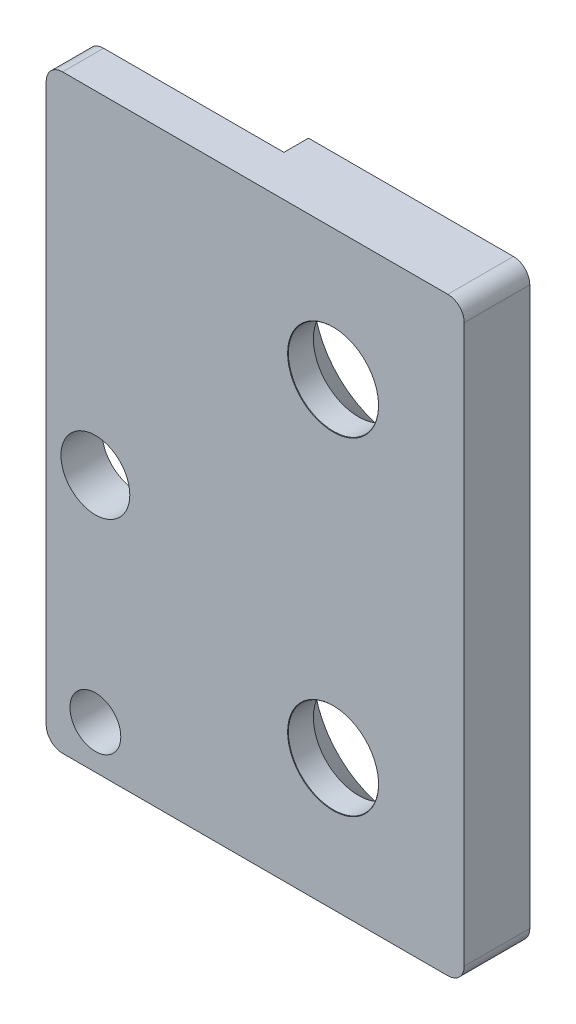
from build123d import *

# Parameters (mm, degrees)
SKETCH1_W                                    = 25.5
SKETCH1_H                                    = 36
BOSS_EXTRUDE1_DEPTH                          = 4
CUT_EXTRUDE1_REACH                           = 40.4
SKETCH2_W                                    = 12
SKETCH2_H                                    = 1.5
CSK_FOR_M5_COUNTERSUNK_FLAT_HEAD_SCR_2_COUNT = 2
CSK_FOR_M5_COUNTERSUNK_FLAT_HEAD_SCR_2_PITCH = 20
M3_CLEARANCE_HOLE1_D                         = 3.1
HOLE1_D                                      = 4.2
FILLET1_R                                    = 1


with BuildPart() as part:
    # Sketch1 → Boss-Extrude1 (new body)
    with BuildSketch(Plane.XY):
        Rectangle(SKETCH1_W, SKETCH1_H)
    extrude(amount=BOSS_EXTRUDE1_DEPTH)

    # Sketch2 → Cut-Extrude1 (cut, up to next)
    with BuildSketch(Plane(origin=(0, 18, 0), x_dir=(1, 0, 0), z_dir=(0, 1, 0)), mode=Mode.PRIVATE) as cut_extrude1_sk1:
        with Locations((-6.75, -0.75)):
            Rectangle(SKETCH2_W, SKETCH2_H)
    cut_extrude1_tool1 = extrude(cut_extrude1_sk1.sketch, amount=-CUT_EXTRUDE1_REACH, mode=Mode.PRIVATE) & part.part
    add(cut_extrude1_tool1.solids().sort_by_distance((-6.75, 18, 0.75))[0], mode=Mode.SUBTRACT)

    # Sketch5 → CSK for M5 Countersunk Flat Head Screw1 (revolve, cut)
    with BuildSketch(Plane(origin=(4.75, 10, 0), x_dir=(0, 1, 0), z_dir=(1, 0, 0))):
        Polygon((0, 0), (0, 4), (2.775, 4), (2.75, 3.975), (2.75, 2.45), (5.2, 0), align=None)
    csk_for_m5_countersunk_flat_head_screw1 = revolve(axis=Axis((4.75, 10, -6.35), (0, 0, 1)), mode=Mode.SUBTRACT)

    # CSK for M5 Countersunk Flat Head Scr 2: CSK for M5 Countersunk Flat Head Screw1 ×2
    with Locations(*[(0, -i * CSK_FOR_M5_COUNTERSUNK_FLAT_HEAD_SCR_2_PITCH, 0) for i in range(1, CSK_FOR_M5_COUNTERSUNK_FLAT_HEAD_SCR_2_COUNT)]):
        add(csk_for_m5_countersunk_flat_head_screw1, mode=Mode.SUBTRACT)

    # M3 Clearance Hole1 (through all)
    with Locations(Plane(origin=(0, 0, 1.5), x_dir=(-1, 0, 0), z_dir=(0, 0, -1))):
        with Locations((9.75, -15.35)):
            Hole(M3_CLEARANCE_HOLE1_D / 2)

    # Hole1 (through all)
    with Locations(Plane(origin=(0, 0, 1.5), x_dir=(-1, 0, 0), z_dir=(0, 0, -1))):
        with Locations((9.75, -2.3)):
            Hole(HOLE1_D / 2)

    # Fillet1
    fillet1_edges = [part.edges().sort_by_distance(p)[0] for p in [
        (-12.75, 18, 2.75),
        (12.75, 18, 2),
        (12.75, -18, 2),
        (-12.75, -18, 2.75),
    ]]
    fillet(fillet1_edges, radius=FILLET1_R)


solid = part.part
